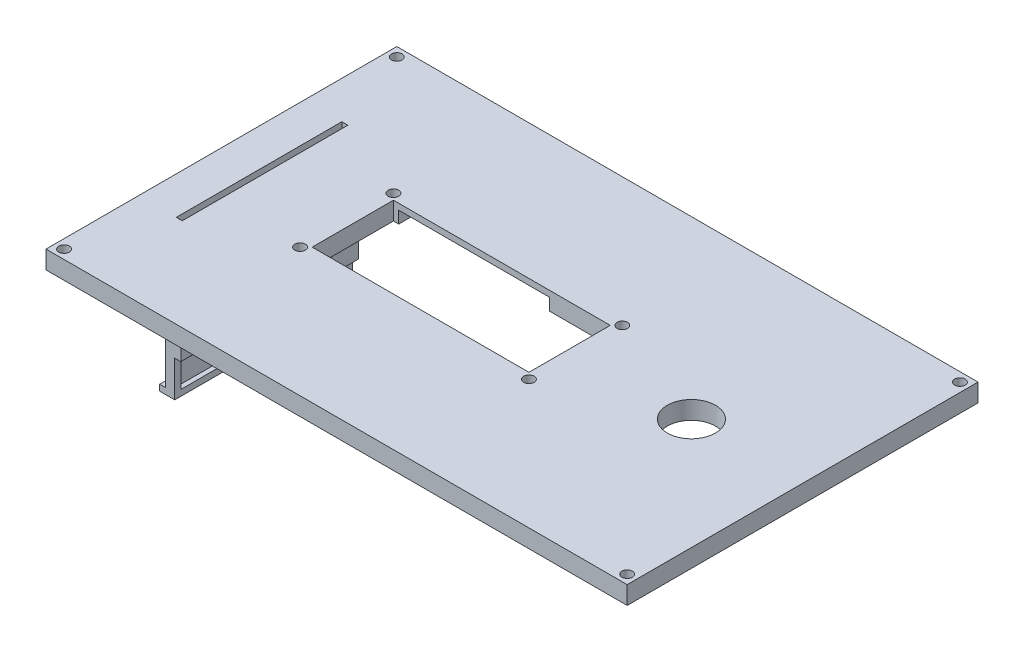
from build123d import *

# Parameters (mm, degrees)
SKETCH1_W            = 193
SKETCH1_H            = 116.5
SKETCH1_R            = 1.75
SKETCH1_R_2          = 8
SKETCH1_W_2          = 72
SKETCH1_H_2          = 27
SKETCH1_W_3          = 2
SKETCH1_H_3          = 55
BOSS_EXTRUDE1_DEPTH  = 6
SKETCH3_W            = 10
SKETCH3_H            = 10
BOSS_EXTRUDE3_DEPTH  = 10
SKETCH5_W            = 2
SKETCH5_H            = 55
BOSS_EXTRUDE4_DEPTH  = 6
SKETCH6_W            = 181
SKETCH6_H            = 104.5
CUT_EXTRUDE1_DEPTH   = 4
SKETCH7_W            = 1.5
SKETCH7_H            = 55
BOSS_EXTRUDE5_DEPTH  = 44.75
SKETCH8_W            = 2
SKETCH8_H            = 55
CUT_EXTRUDE2_DEPTH   = 42.25
SKETCH10_W           = 6
SKETCH10_H           = 19
CUT_EXTRUDE3_DEPTH   = 4
FILLET3_R            = 3
SKETCH12_W           = 55
SKETCH12_H           = 2
BOSS_EXTRUDE6_DEPTH  = 1.5
SKETCH14_W           = 3
SKETCH14_H           = 44.75
BOSS_EXTRUDE7_DEPTH  = 2
SKETCH15_W           = 3
SKETCH15_H           = 44.75
BOSS_EXTRUDE8_DEPTH  = 2
BOSS_EXTRUDE9_DEPTH  = 2
SKETCH18_W           = 20
SKETCH18_H           = 32.75
BOSS_EXTRUDE10_DEPTH = 2
SKETCH19_W           = 50
SKETCH19_H           = 37
CUT_EXTRUDE7_DEPTH   = 4


with BuildPart() as part:
    # Sketch1 → Boss-Extrude1 (new body)
    with BuildSketch(Plane(origin=(0, 0, 0), x_dir=(1, 0, 0), z_dir=(0, 1, 0))):
        with Locations((22.87983871, -17.078434096)):
            Rectangle(SKETCH1_W, SKETCH1_H)
        with Locations(Location((-31.988235573, -1.578434096, 0), (0, 0, 270))):
            Circle(SKETCH1_R, mode=Mode.SUBTRACT)
        with Locations(Location((-31.988235573, -32.578434096, 0), (0, 0, 270))):
            Circle(SKETCH1_R, mode=Mode.SUBTRACT)
        with Locations(Location((44.011764427, -1.578434096, 0), (0, 0, 270))):
            Circle(SKETCH1_R, mode=Mode.SUBTRACT)
        with Locations(Location((44.011764427, -32.578434096, 0), (0, 0, 270))):
            Circle(SKETCH1_R, mode=Mode.SUBTRACT)
        with Locations(Location((-70.62016129, -72.328434096, 0), (0, 0, 270))):
            Circle(SKETCH1_R, mode=Mode.SUBTRACT)
        with Locations(Location((-70.62016129, 38.171565904, 0), (0, 0, 270))):
            Circle(SKETCH1_R, mode=Mode.SUBTRACT)
        with Locations(Location((116.37983871, -72.328434096, 0), (0, 0, 270))):
            Circle(SKETCH1_R, mode=Mode.SUBTRACT)
        with Locations(Location((116.37983871, 38.171565904, 0), (0, 0, 270))):
            Circle(SKETCH1_R, mode=Mode.SUBTRACT)
        with Locations(Location((82.450678359, -17.078434096, 0), (0, 0, 270))):
            Circle(SKETCH1_R_2, mode=Mode.SUBTRACT)
        with Locations((6.011764427, -17.078434096)):
            Rectangle(SKETCH1_W_2, SKETCH1_H_2, mode=Mode.SUBTRACT)
        with Locations((-47.331266899, -17.078434096)):
            Rectangle(SKETCH1_W_3, SKETCH1_H_3, mode=Mode.SUBTRACT)
    extrude(amount=BOSS_EXTRUDE1_DEPTH)

    # Sketch3 → Boss-Extrude3 (add)
    with BuildSketch(Plane.XZ):
        with Locations((-62.62016129, 64.328434096)):
            Rectangle(SKETCH3_W, SKETCH3_H)
        with Locations((-62.62016129, -30.171565904)):
            Rectangle(SKETCH3_W, SKETCH3_H)
        with Locations((108.37983871, -30.171565904)):
            Rectangle(SKETCH3_W, SKETCH3_H)
        with Locations((108.37983871, 64.328434096)):
            Rectangle(SKETCH3_W, SKETCH3_H)
    extrude(amount=BOSS_EXTRUDE3_DEPTH)

    # Sketch5 → Boss-Extrude4 (add)
    with BuildSketch(Plane.XZ):
        with Locations((-47.331266899, 17.078434096)):
            Rectangle(SKETCH5_W, SKETCH5_H)
    extrude(amount=-BOSS_EXTRUDE4_DEPTH)

    # Sketch6 → Cut-Extrude1 (cut)
    with BuildSketch(Plane.XZ.offset(10)):
        with Locations((22.87983871, 17.078434096)):
            Rectangle(SKETCH6_W, SKETCH6_H)
    extrude(amount=-CUT_EXTRUDE1_DEPTH, mode=Mode.SUBTRACT)

    # Sketch7 → Boss-Extrude5 (add)
    with BuildSketch(Plane.XZ):
        with Locations((-61.87016129, 17.078434096)):
            Rectangle(SKETCH7_W, SKETCH7_H)
    extrude(amount=BOSS_EXTRUDE5_DEPTH)

    # Sketch8 → Cut-Extrude2 (cut)
    with BuildSketch(Plane.XZ):
        with Locations((-60.12016129, 17.078434096)):
            Rectangle(SKETCH8_W, SKETCH8_H)
    extrude(amount=-CUT_EXTRUDE2_DEPTH, mode=Mode.SUBTRACT)

    # Sketch10 → Cut-Extrude3 (cut)
    with BuildSketch(Plane.XZ):
        with Locations((45.011764427, 17.078434096)):
            Rectangle(SKETCH10_W, SKETCH10_H)
    extrude(amount=-CUT_EXTRUDE3_DEPTH, mode=Mode.SUBTRACT)

    # Fillet3
    fillet3_edges = [part.edges().sort_by_distance(p)[0] for p in [
        (-67.62016129, -6, 64.328434096),
        (-67.62016129, -6, -30.171565904),
        (-62.62016129, -6, -35.171565904),
        (108.37983871, -6, -35.171565904),
        (-62.62016129, -6, 69.328434096),
        (108.37983871, -6, 69.328434096),
        (113.37983871, -6, -30.171565904),
        (113.37983871, -6, 64.328434096),
        (-62.62016129, -6, 59.328434096),
        (-57.62016129, -6, 64.328434096),
        (103.37983871, -6, 64.328434096),
        (108.37983871, -6, 59.328434096),
        (108.37983871, -6, -25.171565904),
        (103.37983871, -6, -30.171565904),
        (-57.62016129, -6, -30.171565904),
        (-62.62016129, -6, -25.171565904),
    ]]
    fillet(fillet3_edges, radius=FILLET3_R)

    # Sketch12 → Boss-Extrude6 (add)
    with BuildSketch(Plane(origin=(-61.12016129, 0, 0), x_dir=(0, 0, -1), z_dir=(1, 0, 0))):
        with Locations((-17.078434096, -43.75)):
            Rectangle(SKETCH12_W, SKETCH12_H)
    extrude(amount=BOSS_EXTRUDE6_DEPTH)

    # Sketch14 → Boss-Extrude7 (add)
    with BuildSketch(Plane(origin=(0, 0, -10.421565904), x_dir=(-1, 0, 0), z_dir=(0, 0, -1))):
        with Locations((61.12016129, -22.375)):
            Rectangle(SKETCH14_W, SKETCH14_H)
    extrude(amount=BOSS_EXTRUDE7_DEPTH)

    # Sketch15 → Boss-Extrude8 (add)
    with BuildSketch(Plane.XY.offset(44.578434096)):
        with Locations((-61.12016129, -22.375)):
            Rectangle(SKETCH15_W, SKETCH15_H)
    extrude(amount=BOSS_EXTRUDE8_DEPTH)

    # Sketch16 → Boss-Extrude9 (add)
    with BuildSketch(Plane.ZY.offset(62.62016129)):
        Polygon((-10.421565904, 0), (-10.421565904, -42.75), (46.578434096, -42.75), (46.578434096, -44.75), (-12.421565904, -44.75), (-12.421565904, 0), align=None)
    extrude(amount=BOSS_EXTRUDE9_DEPTH)

    # Sketch18 → Boss-Extrude10 (add)
    with BuildSketch(Plane(origin=(-59.62016129, 0, 0), x_dir=(0, 0, -1), z_dir=(1, 0, 0))):
        with Locations((-36.578434096, -16.375)):
            Rectangle(SKETCH18_W, SKETCH18_H)
        with Locations((2.421565904, -16.375)):
            Rectangle(SKETCH18_W, SKETCH18_H)
    extrude(amount=BOSS_EXTRUDE10_DEPTH)

    # Sketch19 → Cut-Extrude7 (cut)
    with BuildSketch(Plane.XZ):
        with Locations((-3.238235573, 17.078434096)):
            Rectangle(SKETCH19_W, SKETCH19_H)
    extrude(amount=-CUT_EXTRUDE7_DEPTH, mode=Mode.SUBTRACT)


solid = part.part
